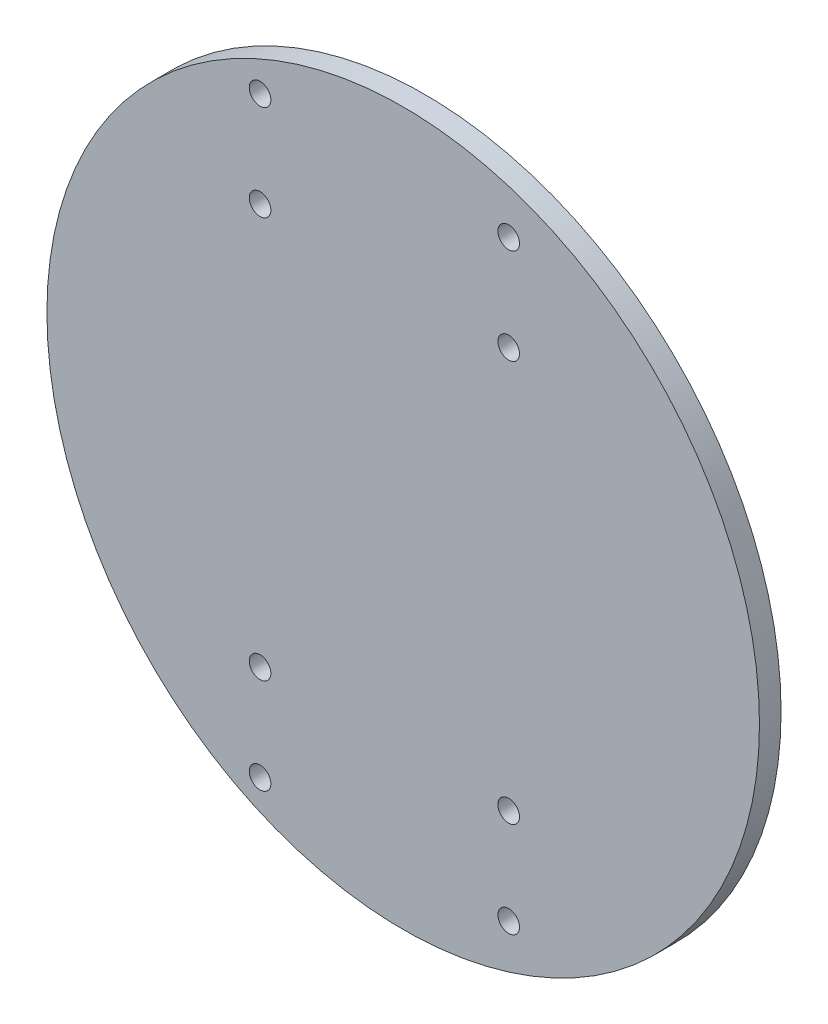
from build123d import *

# Parameters (mm, degrees)
CROQUIS1_R              = 82.42
SALIENTE_EXTRUIR1_DEPTH = 5
CROQUIS3_R              = 2.5
CORTAR_EXTRUIR2_DEPTH   = 10


with BuildPart() as part:
    # Croquis1 → Saliente-Extruir1 (new body)
    with BuildSketch(Plane.XY):
        Circle(CROQUIS1_R)
    extrude(amount=SALIENTE_EXTRUIR1_DEPTH)

    # Croquis3 → Cortar-Extruir2 (cut)
    with BuildSketch(Plane.XY.offset(5)):
        with Locations((-33.115, 68.49)):
            Circle(CROQUIS3_R)
        with Locations((24.405, 68.49)):
            Circle(CROQUIS3_R)
        with Locations((24.405, 46.39)):
            Circle(CROQUIS3_R)
        with Locations((-33.115, 46.39)):
            Circle(CROQUIS3_R)
        with Locations((-33.115, -46.39)):
            Circle(CROQUIS3_R)
        with Locations((-33.115, -68.49)):
            Circle(CROQUIS3_R)
        with Locations((24.405, -46.39)):
            Circle(CROQUIS3_R)
        with Locations((24.405, -68.49)):
            Circle(CROQUIS3_R)
    extrude(amount=-CORTAR_EXTRUIR2_DEPTH, mode=Mode.SUBTRACT)


solid = part.part
